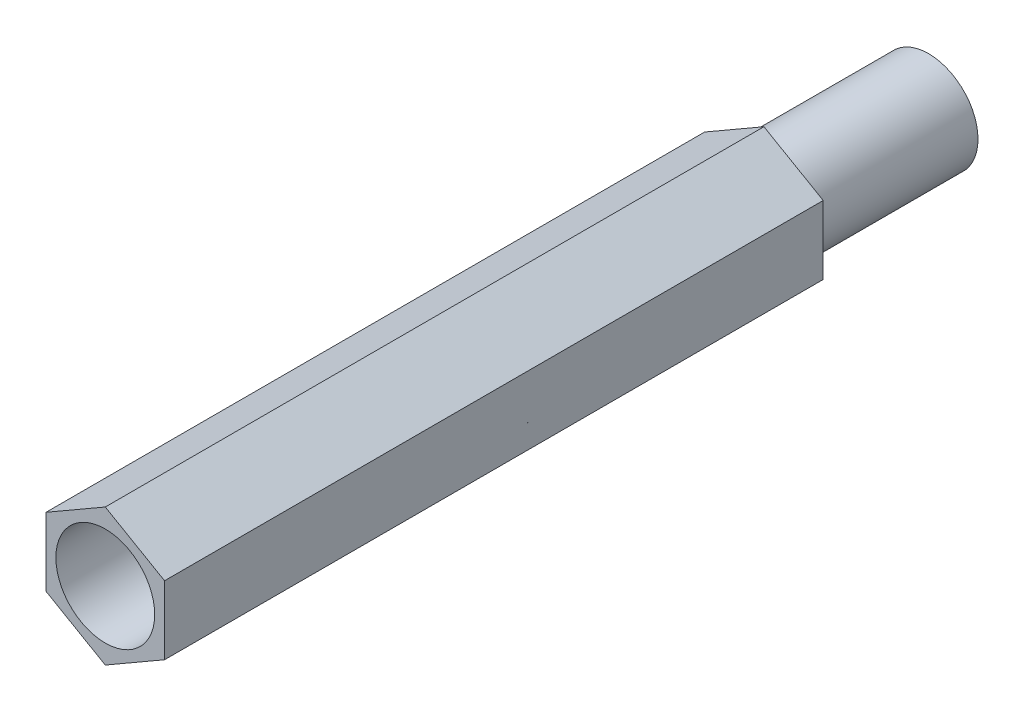
from build123d import *

# Parameters (mm, degrees)
SKETCH_1_R      = 1.5
EXTRUDE_1_DEPTH = 20
SKETCH_2_R      = 1.5
EXTRUDE_2_DEPTH = 5


with BuildPart() as part:
    # 草图1 → 凸台-拉伸1 (new body)
    with BuildSketch(Plane.XY):
        Polygon((0, 2.078460969), (-1.8, 1.039230485), (-1.8, -1.039230485), (0, -2.078460969), (1.8, -1.039230485), (1.8, 1.039230485), align=None)
        Circle(SKETCH_1_R, mode=Mode.SUBTRACT)
    extrude(amount=EXTRUDE_1_DEPTH)

    # 草图2 → 凸台-拉伸2 (add, symmetric)
    with BuildSketch(Plane(origin=(0, 0, 0), x_dir=(-1, 0, 0), z_dir=(0, 0, -1))):
        Circle(SKETCH_2_R)
    extrude(amount=EXTRUDE_2_DEPTH, both=True)


solid = part.part
